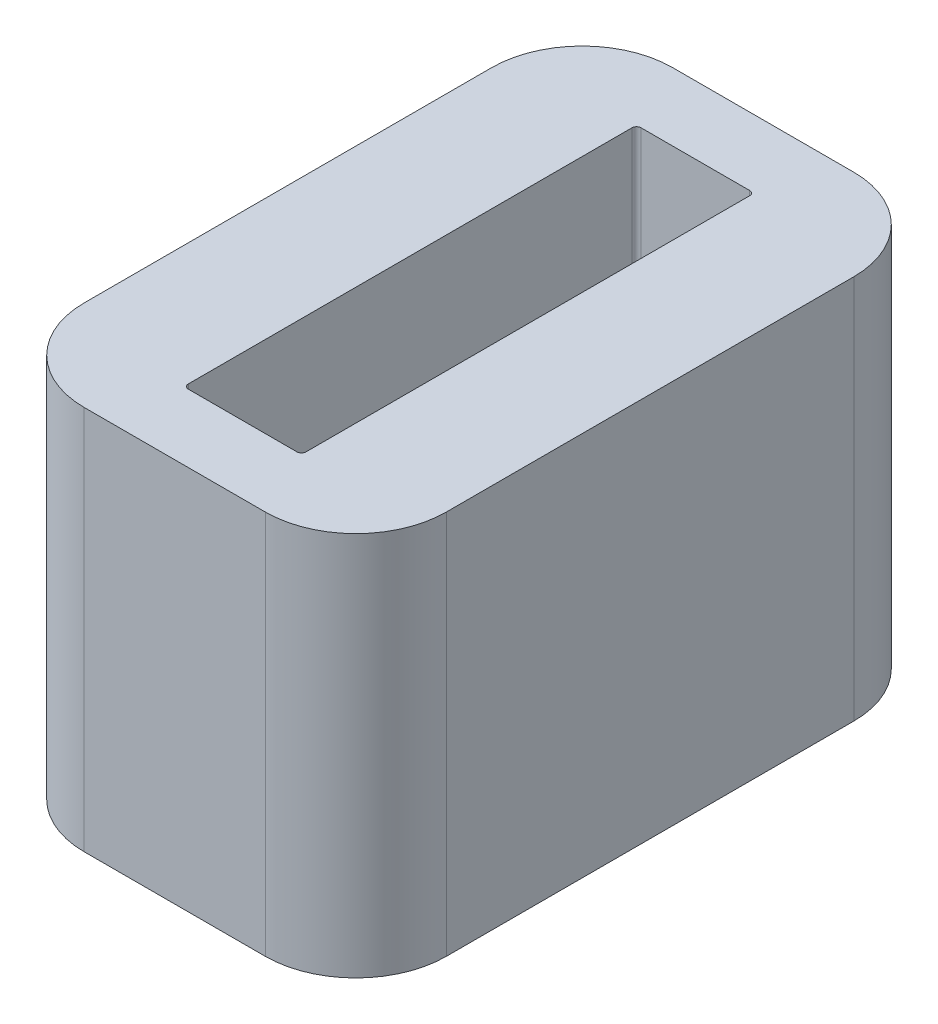
from build123d import *

# Parameters (mm, degrees)
COIL_START = -0.7
SKETCH1_W  = 2.6
SKETCH1_H  = 10
COIL_DEPTH = 8.5
FILLET1_R  = 0.1


with BuildPart() as part:
    # Sketch1 → Coil (new body)
    with BuildSketch(Plane(origin=(0, 97.279475289, 0), x_dir=(1, 0, 0), z_dir=(0, 1, 0)).offset(COIL_START)):
        with BuildLine():
            Line((87.072792821, 72.609367759), (91.072792821, 72.609367759))
            ThreePointArc((91.072792821, 72.609367759), (92.487006384, 73.195154196), (93.072792821, 74.609367759))
            Line((93.072792821, 74.609367759), (93.072792821, 83.609367759))
            ThreePointArc((93.072792821, 83.609367759), (92.487006384, 85.023581321), (91.072792821, 85.609367759))
            Line((91.072792821, 85.609367759), (87.072792821, 85.609367759))
            ThreePointArc((87.072792821, 85.609367759), (85.658579259, 85.023581321), (85.072792821, 83.609367759))
            Line((85.072792821, 83.609367759), (85.072792821, 74.609367759))
            ThreePointArc((85.072792821, 74.609367759), (85.658579259, 73.195154196), (87.072792821, 72.609367759))
        make_face()
        with Locations((89.072792821, 79.109367759)):
            Rectangle(SKETCH1_W, SKETCH1_H, mode=Mode.SUBTRACT)
    extrude(amount=-COIL_DEPTH)

    # Fillet1
    fillet1_edges = [part.edges().sort_by_distance(p)[0] for p in [
        (90.372792821, 92.329475289, -84.109367759),
        (90.372792821, 92.329475289, -74.109367759),
        (87.772792821, 92.329475289, -74.109367759),
        (87.772792821, 92.329475289, -84.109367759),
    ]]
    fillet(fillet1_edges, radius=FILLET1_R)


solid = part.part
